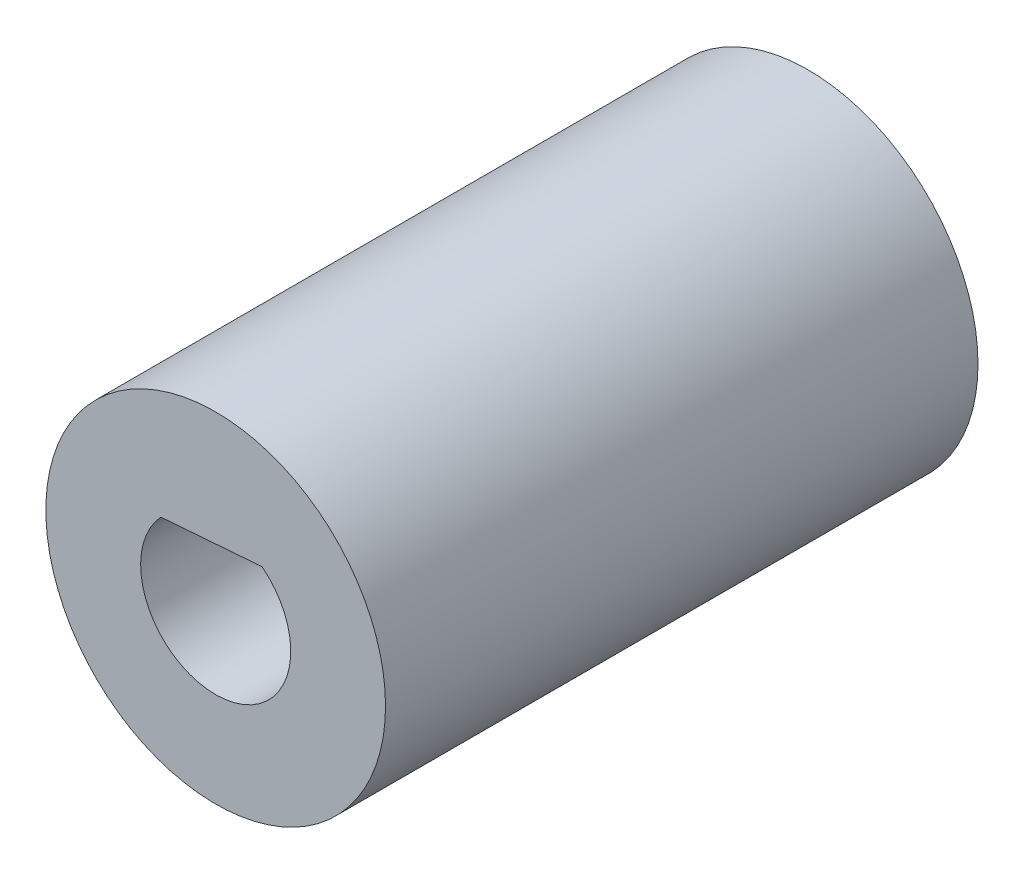
from build123d import *

# Parameters (mm, degrees)
SKETCH1_R           = 4.3
BOSS_EXTRUDE1_DEPTH = 15


with BuildPart() as part:
    # Sketch1 → Boss-Extrude1 (new body)
    with BuildSketch(Plane.XY):
        Circle(SKETCH1_R)
        with BuildLine():
            Line((-1.38630931, 1.299286918), (1.175441567, 1.492761576))
            ThreePointArc((1.175441567, 1.492761576), (0.143088826, -1.894604335), (-1.38630931, 1.299286918))
        make_face(mode=Mode.SUBTRACT)
    extrude(amount=BOSS_EXTRUDE1_DEPTH)


solid = part.part
